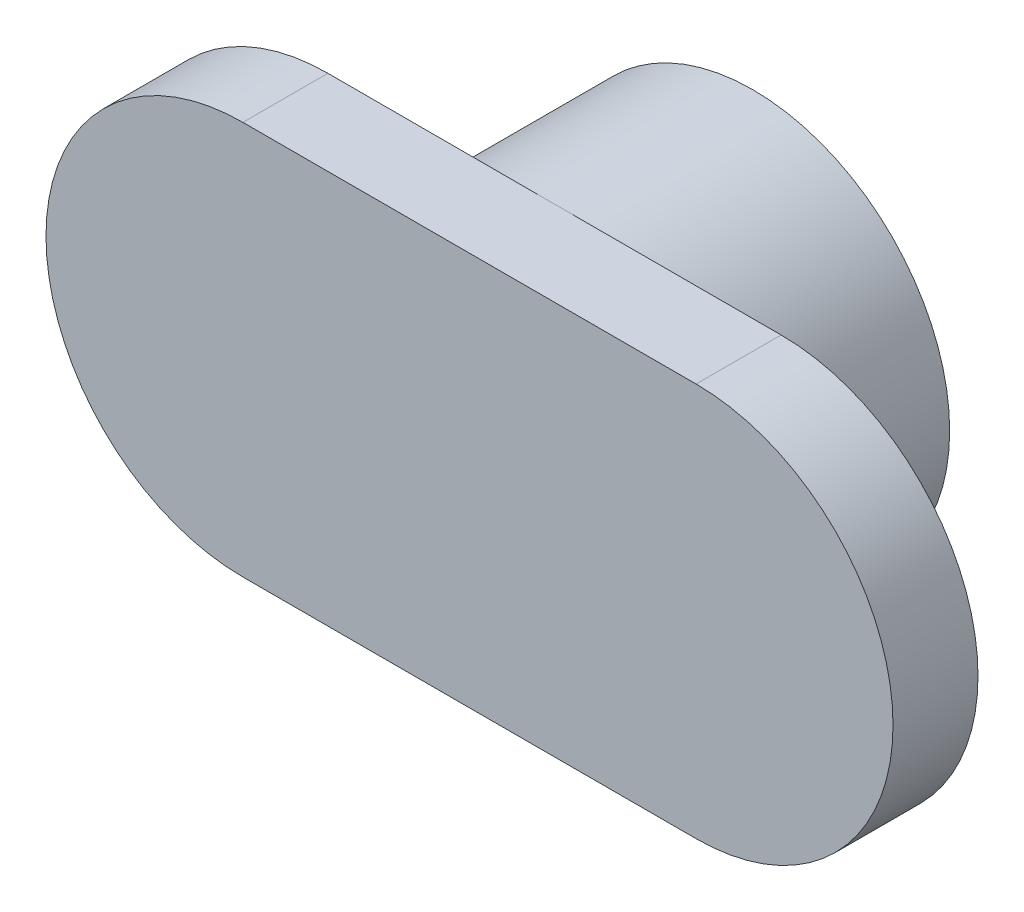
from build123d import *

# Parameters (mm, degrees)
SKIZZE1_R                       = 3.475
AUFSATZ_LINEAR_AUSTRAGEN1_DEPTH = 3.5
AUFSATZ_LINEAR_AUSTRAGEN2_DEPTH = 1.5


with BuildPart() as part:
    # Skizze1 → Aufsatz-Linear austragen1 (new body)
    with BuildSketch(Plane.XY):
        Circle(SKIZZE1_R)
    extrude(amount=AUFSATZ_LINEAR_AUSTRAGEN1_DEPTH)

    # Skizze2 → Aufsatz-Linear austragen2 (add)
    with BuildSketch(Plane.XY.offset(3.5)):
        with BuildLine():
            Line((-4, 3.475), (4, 3.475))
            ThreePointArc((4, 3.475), (7.475, 0), (4, -3.475))
            Line((4, -3.475), (-4, -3.475))
            ThreePointArc((-4, -3.475), (-7.475, 0), (-4, 3.475))
        make_face()
    extrude(amount=AUFSATZ_LINEAR_AUSTRAGEN2_DEPTH)


solid = part.part
